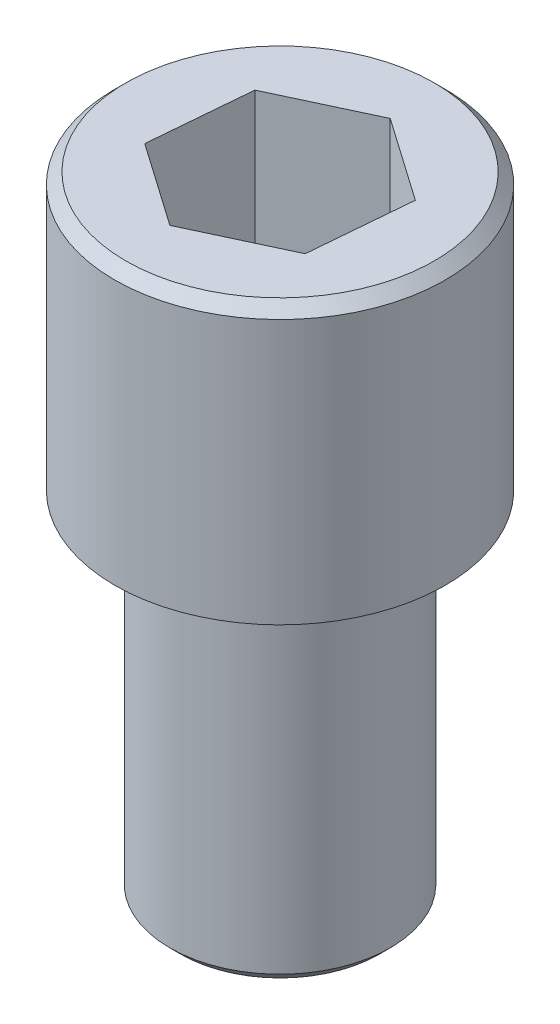
from build123d import *

# Parameters (mm, degrees)
SKICA1_R                 = 2.5
P_IDAT_VYSUNUT_M1_DEPTH  = 8
SKICA2_R                 = 3.75
P_IDAT_VYSUNUT_M2_DEPTH  = 6.25
ODEBRAT_VYSUNUT_M1_DEPTH = 3.75
ZKOSEN_1_SIZE            = 0.25


with BuildPart() as part:
    # Skica1 → Přidat vysunutím1 (new body)
    with BuildSketch(Plane(origin=(0, 0, 0), x_dir=(1, 0, 0), z_dir=(0, 1, 0))):
        with Locations(Location((0, 0, 0), (0, 0, 270))):
            Circle(SKICA1_R)
    extrude(amount=P_IDAT_VYSUNUT_M1_DEPTH)

    # Skica2 → Přidat vysunutím2 (add)
    with BuildSketch(Plane(origin=(0, 8, 0), x_dir=(1, 0, 0), z_dir=(0, 1, 0))):
        with Locations(Location((0, 0, 0), (0, 0, 270))):
            Circle(SKICA2_R)
    extrude(amount=P_IDAT_VYSUNUT_M2_DEPTH)

    # Skica3 → Odebrat vysunutím1 (cut)
    with BuildSketch(Plane(origin=(0, 14.25, 0), x_dir=(1, 0, 0), z_dir=(0, 1, 0))):
        Polygon((-0.199101745, -2.300802431), (1.893002482, -1.322828385), (2.092104227, 0.977974047), (0.199101745, 2.300802431), (-1.893002482, 1.322828385), (-2.092104227, -0.977974047), align=None)
    extrude(amount=-ODEBRAT_VYSUNUT_M1_DEPTH, mode=Mode.SUBTRACT)

    # Zkosení1
    zkosen_1_edges = [part.edges().sort_by_distance(p)[0] for p in [
        (0, 0, -2.5),
        (0, 14.25, -3.75),
    ]]
    chamfer(zkosen_1_edges, length=ZKOSEN_1_SIZE)


solid = part.part
